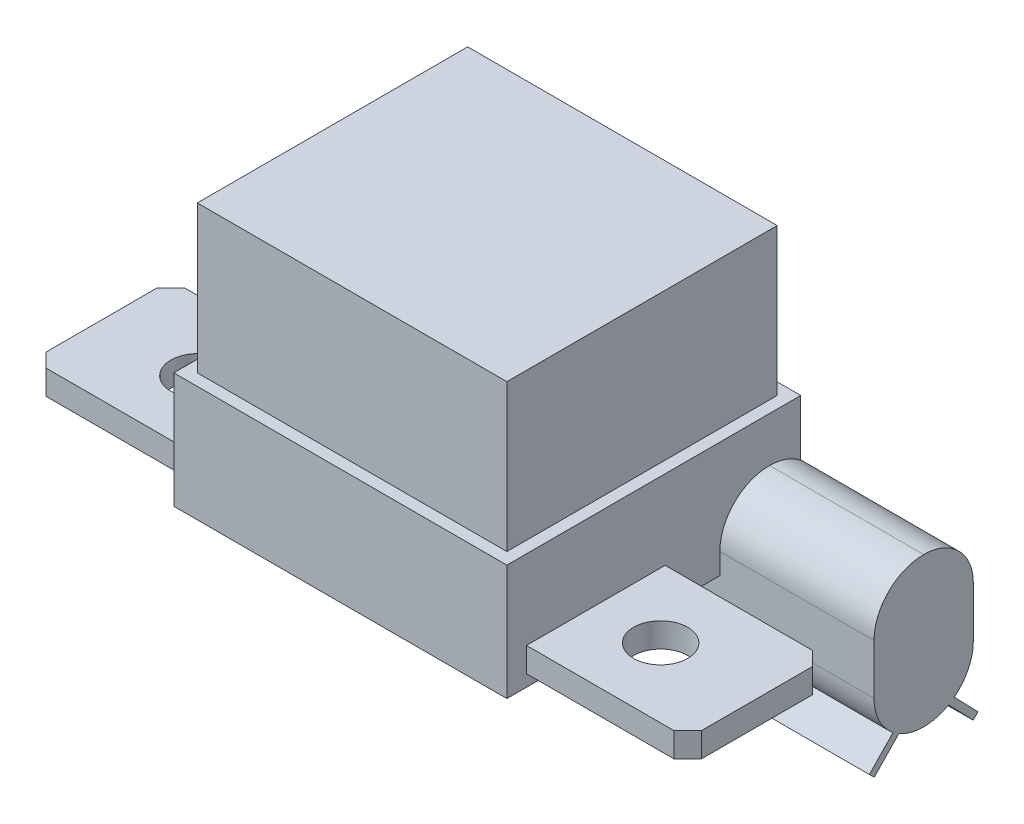
from build123d import *

# Parameters (mm, degrees)
SKETCH1_W                = 43.18
SKETCH1_H                = 38.1
BOSS_EXTRUDE1_DEPTH      = 14.986
SKETCH3_W                = 40.132
SKETCH3_H                = 35.052
BOSS_EXTRUDE2_DEPTH      = 19.0754
SKETCH4_W                = 17.9832
SKETCH4_H                = 3.175
BOSS_EXTRUDE3_DEPTH      = 20.9042
SKETCH6_R                = 3.5052
CUT_EXTRUDE2_DEPTH       = 81.128304758
CHAMFER1_SIZE            = 1.79578
CHAMFER2_SIZE            = 1.79578
BOSS_EXTRUDE4_DEPTH      = 19.9898
BOSS_EXTRUDE4_DEPTH_BACK = 7.47522
BOSS_EXTRUDE5_DEPTH      = 19.9898


with BuildPart() as part:
    # Sketch1 → Boss-Extrude1 (new body)
    with BuildSketch(Plane(origin=(0, 0, 0), x_dir=(1, 0, 0), z_dir=(0, 1, 0))):
        with Locations((21.59, 19.05)):
            Rectangle(SKETCH1_W, SKETCH1_H)
    extrude(amount=BOSS_EXTRUDE1_DEPTH)

    # Sketch3 → Boss-Extrude2 (add)
    with BuildSketch(Plane(origin=(0, 14.986, 0), x_dir=(1, 0, 0), z_dir=(0, 1, 0))):
        with Locations((21.59, 19.05)):
            Rectangle(SKETCH3_W, SKETCH3_H)
    extrude(amount=BOSS_EXTRUDE2_DEPTH)

    # Sketch4 → Boss-Extrude3 (add)
    with BuildSketch(Plane.ZY):
        with Locations((-11.5316, 3.1115)):
            Rectangle(SKETCH4_W, SKETCH4_H)
    boss_extrude3 = extrude(amount=BOSS_EXTRUDE3_DEPTH)

    # Mirror1: Boss-Extrude3 across plane
    add(boss_extrude3.mirror(Plane(origin=(21.59, 0, 0), x_dir=(0, 0, 1), z_dir=(1, 0, 0))))

    # Sketch6 → Cut-Extrude2 (cut, through all)
    with BuildSketch(Plane(origin=(0, 4.699, 0), x_dir=(1, 0, 0), z_dir=(0, 1, 0))):
        with Locations((-8.4074, 11.5316)):
            Circle(SKETCH6_R)
    cut_extrude2 = extrude(amount=-CUT_EXTRUDE2_DEPTH, mode=Mode.SUBTRACT)

    # Mirror3: Cut-Extrude2 across plane
    add(cut_extrude2.mirror(Plane(origin=(21.59, 0, 0), x_dir=(0, 0, 1), z_dir=(1, 0, 0))), mode=Mode.SUBTRACT)

    # Chamfer1
    chamfer1_edges = [part.edges().sort_by_distance(p)[0] for p in [
        (64.0842, 3.1115, -2.54),
        (64.0842, 3.1115, -20.5232),
    ]]
    chamfer(chamfer1_edges, length=CHAMFER1_SIZE)

    # Chamfer2
    chamfer2_edges = [part.edges().sort_by_distance(p)[0] for p in [
        (-20.9042, 3.1115, -2.54),
        (-20.9042, 3.1115, -20.5232),
    ]]
    chamfer(chamfer2_edges, length=CHAMFER2_SIZE)

    # Sketch7 → Boss-Extrude4 (add, two sides: drawn at the far end of the back side and taken through both)
    with BuildSketch(Plane(origin=(43.18, 0, 0), x_dir=(0, 0, -1), z_dir=(1, 0, 0)).offset(-BOSS_EXTRUDE4_DEPTH_BACK)):
        with BuildLine():
            Line((34.0614, 9.144), (34.036, 9.144))
            ThreePointArc((34.036, 9.144), (29.491990403, 7.261809597), (27.6098, 2.7178))
            Line((27.6098, 2.7178), (27.6098, -3.7719))
            ThreePointArc((27.6098, -3.7719), (29.495710147, -8.324889853), (34.0487, -10.2108))
            Line((34.0487, -10.2108), (34.0614, -10.2108))
            ThreePointArc((34.0614, -10.2108), (38.605409597, -8.328609597), (40.4876, -3.7846))
            Line((40.4876, -3.7846), (40.4876, 2.7178))
            ThreePointArc((40.4876, 2.7178), (38.605409597, 7.261809597), (34.0614, 9.144))
        make_face()
    extrude(amount=BOSS_EXTRUDE4_DEPTH + BOSS_EXTRUDE4_DEPTH_BACK)

    # Sketch7<3> → Boss-Extrude5 (add)
    with BuildSketch(Plane(origin=(43.18, 0, 0), x_dir=(0, 0, -1), z_dir=(1, 0, 0))):
        Polygon((27.646762836, -12.6492), (34.0487, -6.0198), (40.450637164, -12.6492), (41.090130246, -12.031648709), (34.0487, -4.740034236), (27.007269754, -12.031648709), align=None)
    extrude(amount=BOSS_EXTRUDE5_DEPTH)


solid = part.part
